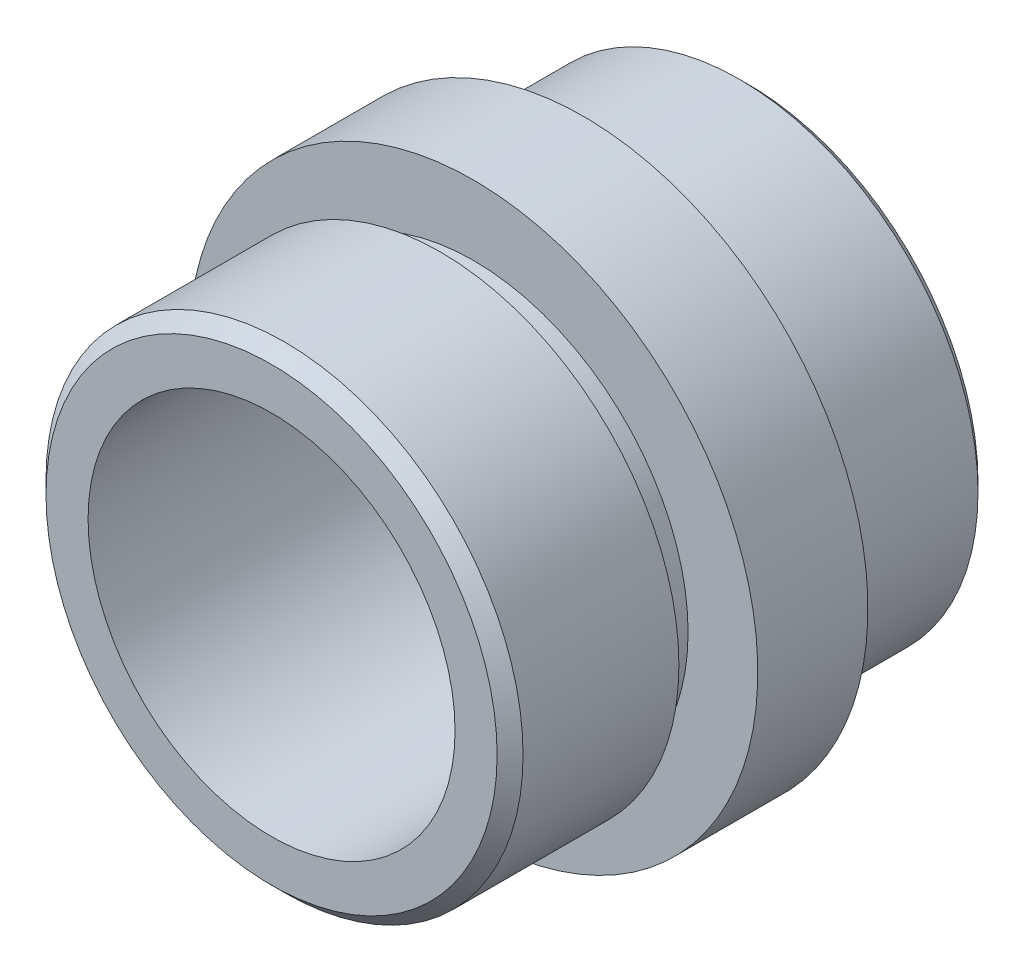
from build123d import *


with BuildPart() as part:
    # Эскиз1 → Повернуть1 (revolve)
    with BuildSketch(Plane.XZ, mode=Mode.PRIVATE) as revolve_1_sk:
        Polygon((11.7, 16.8), (13, 16.8), (13, 25.292893219), (12.292893219, 26), (10, 26), (10, 1), (11, 0), (12.5, 0), (13, 0.5), (13, 7.7), (11.7, 7.7), (11.7, 9), (15.5, 9), (15.5, 15), (11.7, 15), align=None)
    revolve(revolve_1_sk.sketch.rotate(Axis((0, 0, 26.005), (0, 0, -1)), 180), axis=Axis((0, 0, 26.005), (0, 0, -1)))


solid = part.part
